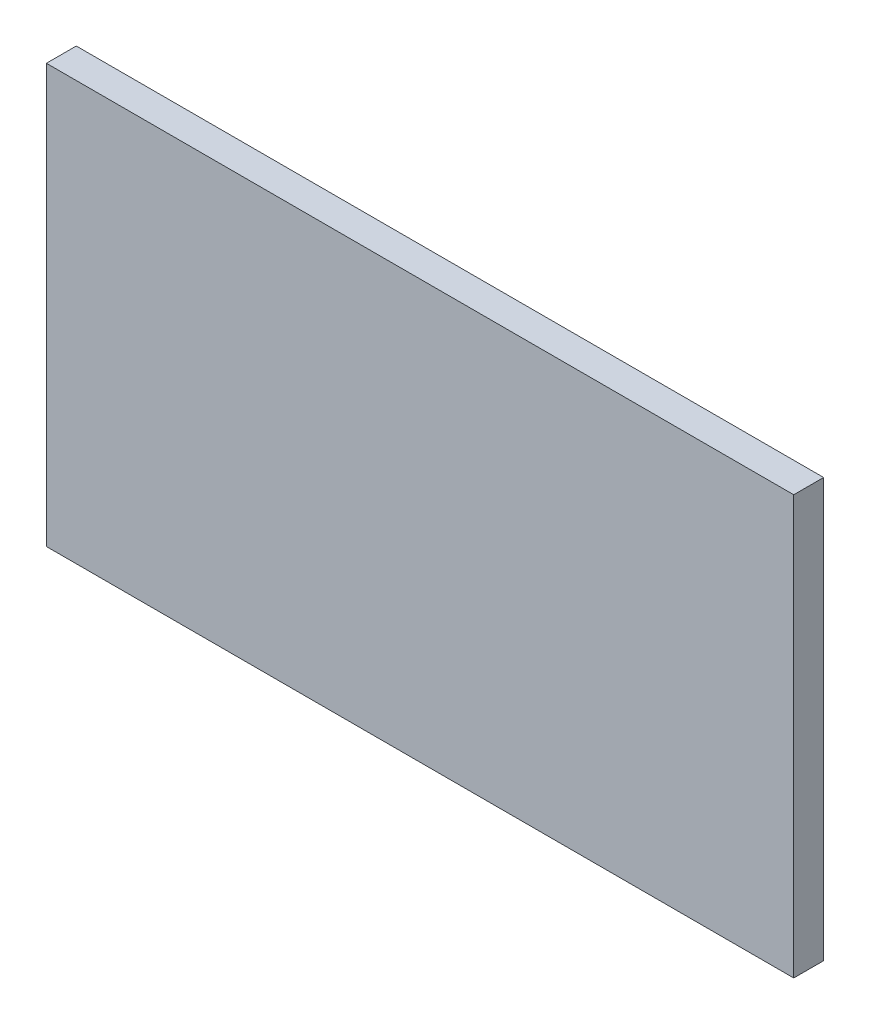
from build123d import *

# Parameters (mm, degrees)
SKETCH1_W           = 317.5
SKETCH1_H           = 177.8
BOSS_EXTRUDE1_DEPTH = 12.7


with BuildPart() as part:
    # Sketch1 → Boss-Extrude1 (new body)
    with BuildSketch(Plane.XY):
        Rectangle(SKETCH1_W, SKETCH1_H)
    extrude(amount=BOSS_EXTRUDE1_DEPTH)


solid = part.part
